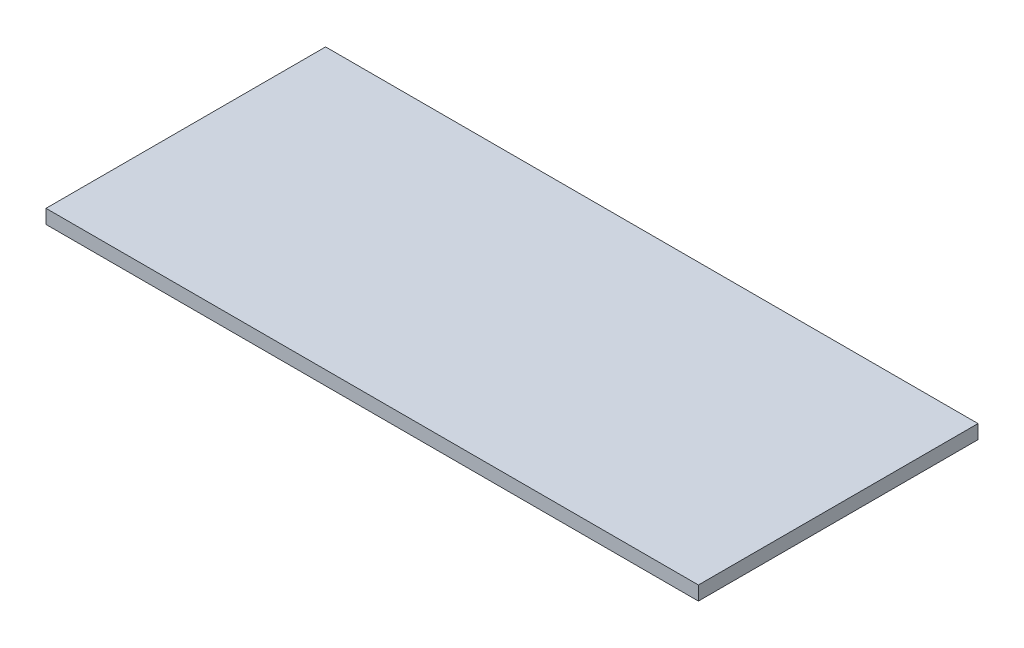
from build123d import *

# Parameters (mm, degrees)
ESBO_O1_W                = 700
ESBO_O1_H                = 300
RESSALTO_EXTRUS_O1_DEPTH = 15


with BuildPart() as part:
    # Esboço1 → Ressalto-extrusão1 (new body)
    with BuildSketch(Plane(origin=(0, 0, 0), x_dir=(1, 0, 0), z_dir=(0, 1, 0))):
        Rectangle(ESBO_O1_W, ESBO_O1_H)
    extrude(amount=RESSALTO_EXTRUS_O1_DEPTH)


solid = part.part
